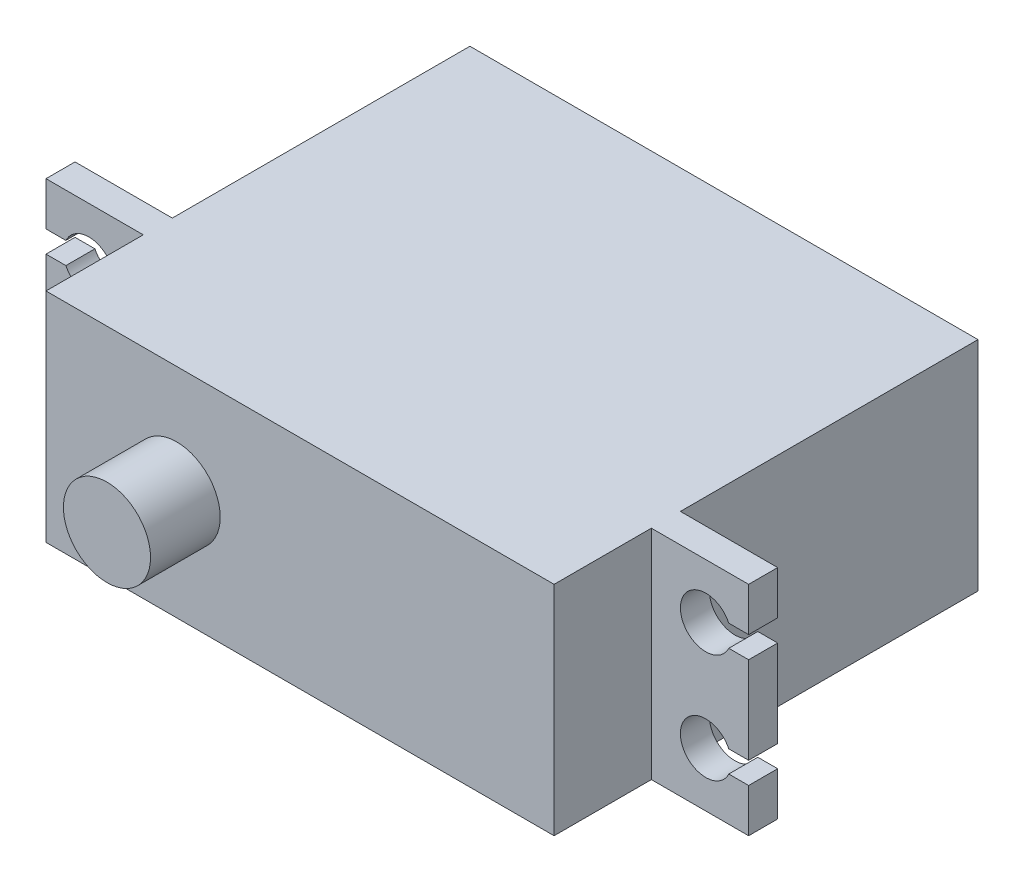
from build123d import *

# Parameters (mm, degrees)
SZKIC1_W                    = 35
SZKIC1_H                    = 15
DODANIE_WYCI_GNI_CIE1_DEPTH = 20.5
DODANIE_WYCI_GNI_CIE2_DEPTH = 2
SZKIC3_W                    = 35
SZKIC3_H                    = 15
DODANIE_WYCI_GNI_CIE3_DEPTH = 6.7
SZKIC4_R                    = 3
DODANIE_WYCI_GNI_CIE4_DEPTH = 4.8


with BuildPart() as part:
    # Szkic1 → Dodanie-wyciągnięcie1 (new body)
    with BuildSketch(Plane.XY):
        Rectangle(SZKIC1_W, SZKIC1_H)
    extrude(amount=DODANIE_WYCI_GNI_CIE1_DEPTH)

    # Szkic2 → Dodanie-wyciągnięcie2 (add)
    with BuildSketch(Plane.XY.offset(20.5)):
        with BuildLine():
            Line((-24.2, 7.5), (24.2, 7.5))
            Line((24.2, 7.5), (24.2, 4.5))
            Line((24.2, 4.5), (22.83113883, 4.5))
            ThreePointArc((22.83113883, 4.5), (19.5, 3.75), (22.83113883, 3))
            Line((22.83113883, 3), (24.2, 3))
            Line((24.2, 3), (24.2, -3))
            Line((24.2, -3), (22.83113883, -3))
            ThreePointArc((22.83113883, -3), (19.5, -3.75), (22.83113883, -4.5))
            Line((22.83113883, -4.5), (24.2, -4.5))
            Line((24.2, -4.5), (24.2, -7.5))
            Line((24.2, -7.5), (-24.2, -7.5))
            Line((-24.2, -7.5), (-24.2, -4.5))
            Line((-24.2, -4.5), (-22.83113883, -4.5))
            ThreePointArc((-22.83113883, -4.5), (-19.5, -3.75), (-22.83113883, -3))
            Line((-22.83113883, -3), (-24.2, -3))
            Line((-24.2, -3), (-24.2, 3))
            Line((-24.2, 3), (-22.83113883, 3))
            ThreePointArc((-22.83113883, 3), (-19.5, 3.75), (-22.83113883, 4.5))
            Line((-22.83113883, 4.5), (-24.2, 4.5))
            Line((-24.2, 4.5), (-24.2, 7.5))
        make_face()
    extrude(amount=DODANIE_WYCI_GNI_CIE2_DEPTH)

    # Szkic3 → Dodanie-wyciągnięcie3 (add)
    with BuildSketch(Plane.XY.offset(22.5)):
        Rectangle(SZKIC3_W, SZKIC3_H)
    extrude(amount=DODANIE_WYCI_GNI_CIE3_DEPTH)

    # Szkic4 → Dodanie-wyciągnięcie4 (add)
    with BuildSketch(Plane.XY.offset(29.2)):
        with Locations((-8.5, 0)):
            Circle(SZKIC4_R)
    extrude(amount=DODANIE_WYCI_GNI_CIE4_DEPTH)


solid = part.part
